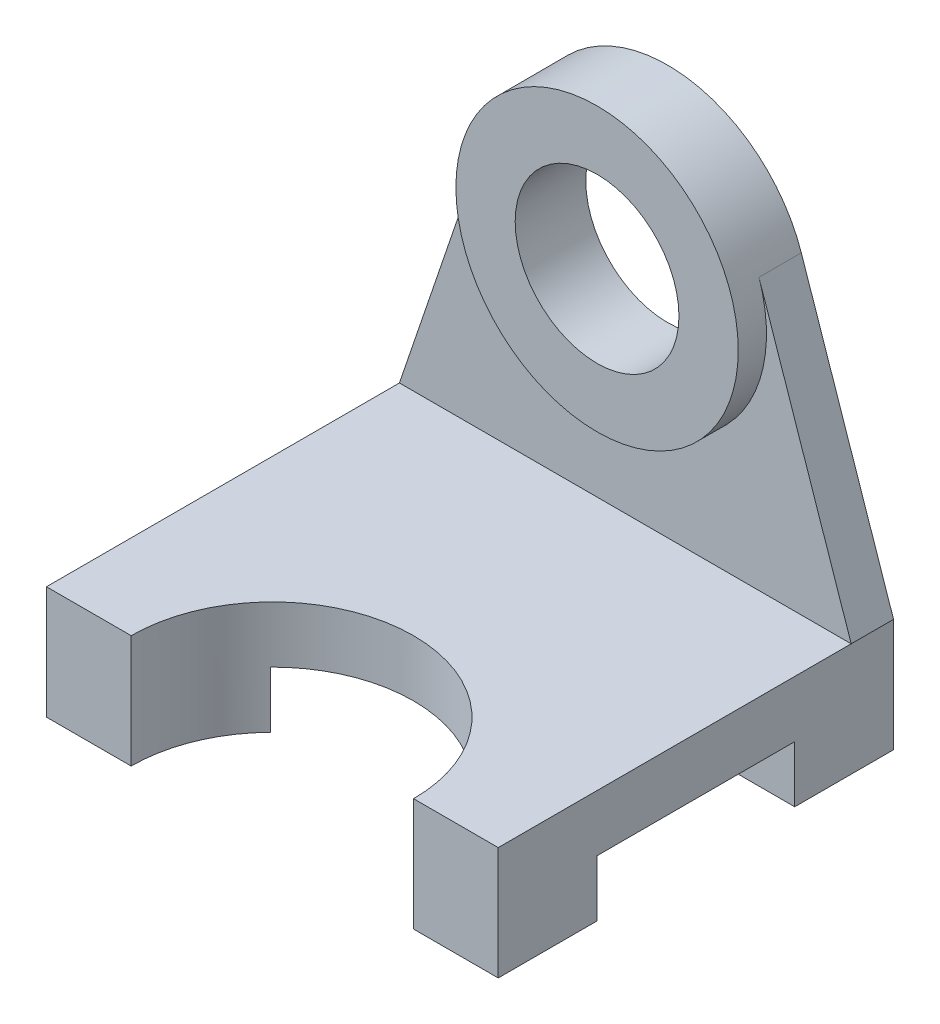
from build123d import *

# Parameters (mm, degrees)
EXTRUDE_1_DEPTH          = 40
CUT_EXTRUDE_1_DEPTH      = 217.333076528
CUT_EXTRUDE_1_DEPTH_BACK = 217.333076528
SKETCH_4_W               = 70
SKETCH_4_H               = 20
EXTRUDE_2_DEPTH          = 15
EXTRUDE_3_DEPTH          = 25


with BuildPart() as part:
    # 草图1 → 凸台-拉伸1 (new body)
    with BuildSketch(Plane(origin=(0, 0, 0), x_dir=(1, 0, 0), z_dir=(0, 1, 0))):
        with BuildLine():
            Line((160, 0), (0, 0))
            Line((0, 0), (0, -140))
            Line((0, -140), (30, -140))
            ThreePointArc((30, -140), (80, -90), (130, -140))
            Line((130, -140), (160, -140))
            Line((160, -140), (160, 0))
        make_face()
    extrude(amount=EXTRUDE_1_DEPTH)

    # 草图4 → 切除-拉伸1 (cut, two sides: drawn at the far end of the back side and taken through both)
    with BuildSketch(Plane.ZY.offset(-CUT_EXTRUDE_1_DEPTH_BACK)):
        with Locations((70, 10)):
            Rectangle(SKETCH_4_W, SKETCH_4_H)
    extrude(amount=CUT_EXTRUDE_1_DEPTH + CUT_EXTRUDE_1_DEPTH_BACK, mode=Mode.SUBTRACT)

    # 草图5 → 凸台-拉伸2 (add)
    with BuildSketch(Plane(origin=(0, 0, 0), x_dir=(-1, 0, 0), z_dir=(0, 0, -1))):
        with BuildLine():
            Line((-160, 40), (0, 40))
            Line((0, 40), (-32.659713859, 136.090286141))
            ThreePointArc((-32.659713859, 136.090286141), (-80, 70), (-127.340286141, 136.090286141))
            Line((-127.340286141, 136.090286141), (-160, 40))
        make_face()
    extrude(amount=-EXTRUDE_2_DEPTH)

    # 草图5<3> → 凸台-拉伸3 (add)
    with BuildSketch(Plane(origin=(0, 0, 0), x_dir=(-1, 0, 0), z_dir=(0, 0, -1))):
        with BuildLine():
            ThreePointArc((-127.340286141, 136.090286141), (-120.647966167, 90.883976122), (-80, 70))
            ThreePointArc((-80, 70), (-44.644660941, 84.644660941), (-30, 120))
            ThreePointArc((-30, 120), (-30.669409556, 128.154314593), (-32.659713859, 136.090286141))
            ThreePointArc((-32.659713859, 136.090286141), (-80, 170), (-127.340286141, 136.090286141))
        make_face()
        with BuildLine():
            ThreePointArc((-51, 120), (-59.493903346, 99.493903346), (-80, 91))
            ThreePointArc((-80, 91), (-100.506096654, 140.506096654), (-51, 120))
        make_face(mode=Mode.SUBTRACT)
    extrude(amount=-EXTRUDE_3_DEPTH)


solid = part.part
